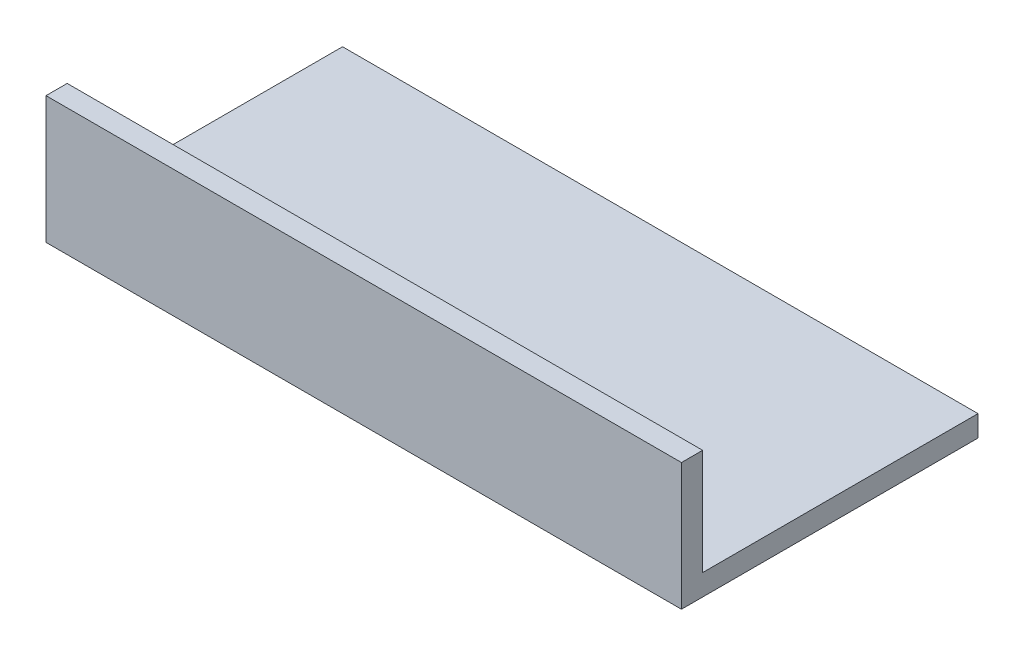
from build123d import *

# Parameters (mm, degrees)
SKETCH_1_W      = 150
SKETCH_1_H      = 25
EXTRUDE_1_DEPTH = 5
SKETCH_3_W      = 150
SKETCH_3_H      = 70
EXTRUDE_2_DEPTH = 5


with BuildPart() as part:
    # ｽｹｯﾁ1 → ﾎﾞｽ - 押し出し1 (new body)
    with BuildSketch(Plane.XY):
        Rectangle(SKETCH_1_W, SKETCH_1_H)
    extrude(amount=EXTRUDE_1_DEPTH)

    # ｽｹｯﾁ3 → ﾎﾞｽ - 押し出し2 (add)
    with BuildSketch(Plane.XZ.offset(12.5)):
        with Locations((0, -30)):
            Rectangle(SKETCH_3_W, SKETCH_3_H)
    extrude(amount=EXTRUDE_2_DEPTH)


solid = part.part
